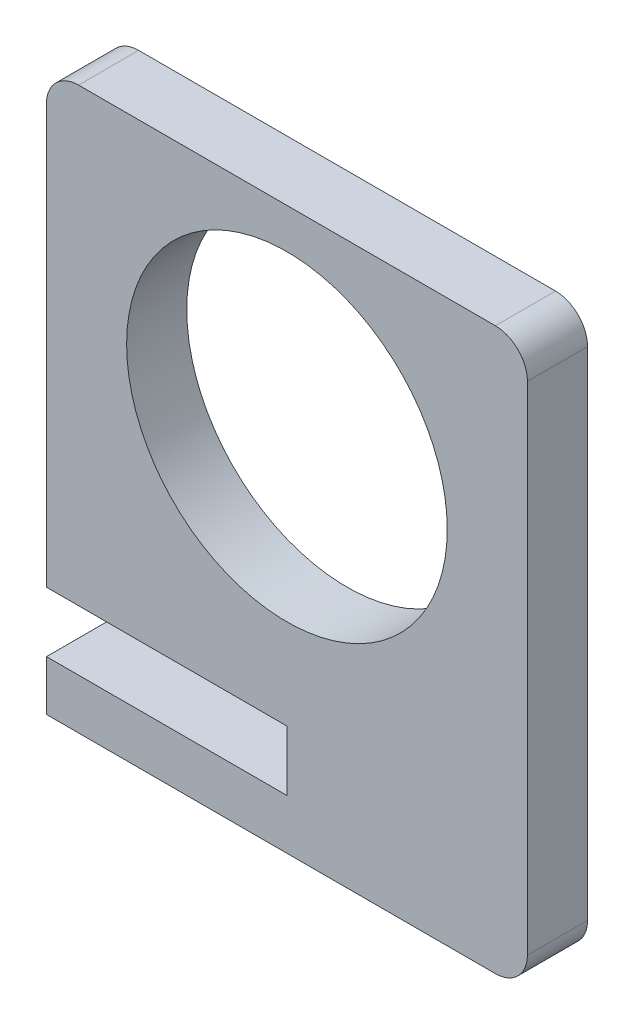
from build123d import *

# Parameters (mm, degrees)
SKETCH1_W           = 38.1
SKETCH1_H           = 31.75
SKETCH1_R           = 12.7
BOSS_EXTRUDE1_DEPTH = 2.38125
FILLET1_R           = 2.54


with BuildPart() as part:
    # Sketch1 → Boss-Extrude1 (new, symmetric)
    # profile 1 of 2: a face of its own
    with BuildSketch(Plane.XY):
        Polygon((-19.05, 6.35), (-19.05, 2.38125), (0, 2.38125), (0, -2.38125), (-19.05, -2.38125), (-19.05, -6.35), (19.05, -6.35), (19.05, 6.35), align=None)
    # profile 2 of 2: a face of its own
    with BuildSketch(Plane.XY):
        with Locations((0, 22.225)):
            Rectangle(SKETCH1_W, SKETCH1_H)
        with Locations(Location((0, 22.225, 0), (0, 0, 180))):
            Circle(SKETCH1_R, mode=Mode.SUBTRACT)
    extrude(amount=BOSS_EXTRUDE1_DEPTH, both=True)

    # Fillet1
    fillet1_edges = [part.edges().sort_by_distance(p)[0] for p in [
        (-19.05, 38.1, 0),
        (19.05, 38.1, 0),
        (19.05, -6.35, 0),
    ]]
    fillet(fillet1_edges, radius=FILLET1_R)


solid = part.part
